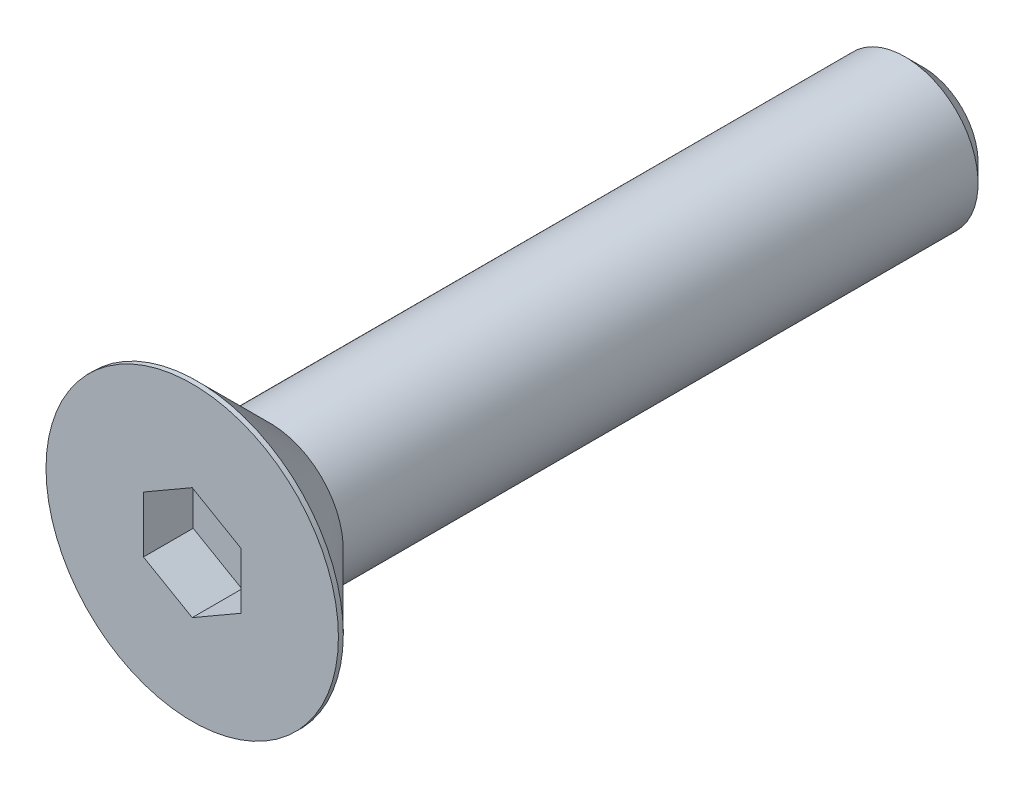
from build123d import *

# Parameters (mm, degrees)
CUT_EXTRUDE2_DEPTH = 1.02


with BuildPart() as part:
    # Sketch14 → Revolve1 (revolve)
    with BuildSketch(Plane(origin=(0, 0, 0), x_dir=(0, 0, -1), z_dir=(1, 0, 0)), mode=Mode.PRIVATE) as revolve1_sk:
        Polygon((-8.35, 0), (-8.35, 3), (-8.25, 3), (-6.75, 1.5), (-6.65, 1.5), (6.275, 1.5), (6.65, 1.125), (6.65, 0), align=None)
    revolve(revolve1_sk.sketch.rotate(Axis((0, 0, -6.65), (0, 0, 1)), 90), axis=Axis((0, 0, -6.65), (0, 0, 1)))

    # Sketch5 → Cut-Extrude2 (cut)
    with BuildSketch(Plane.XY.offset(8.35)):
        Polygon((0, -1.154700538), (1, -0.577350269), (1, 0.577350269), (0, 1.154700538), (-1, 0.577350269), (-1, -0.577350269), align=None)
    extrude(amount=-CUT_EXTRUDE2_DEPTH, mode=Mode.SUBTRACT)


solid = part.part
